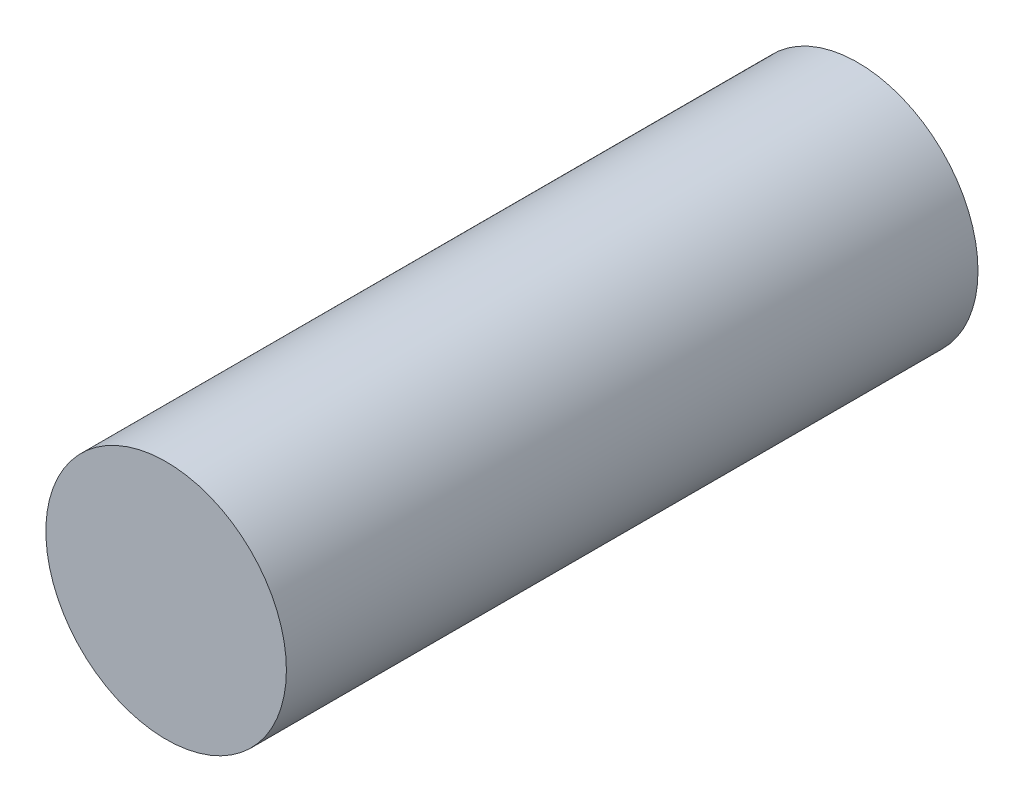
from build123d import *

# Parameters (mm, degrees)
SKETCH1_R           = 6.35
BOSS_EXTRUDE1_DEPTH = 36.5125


with BuildPart() as part:
    # Sketch1 → Boss-Extrude1 (new body)
    with BuildSketch(Plane.XY):
        Circle(SKETCH1_R)
    extrude(amount=BOSS_EXTRUDE1_DEPTH)


solid = part.part
